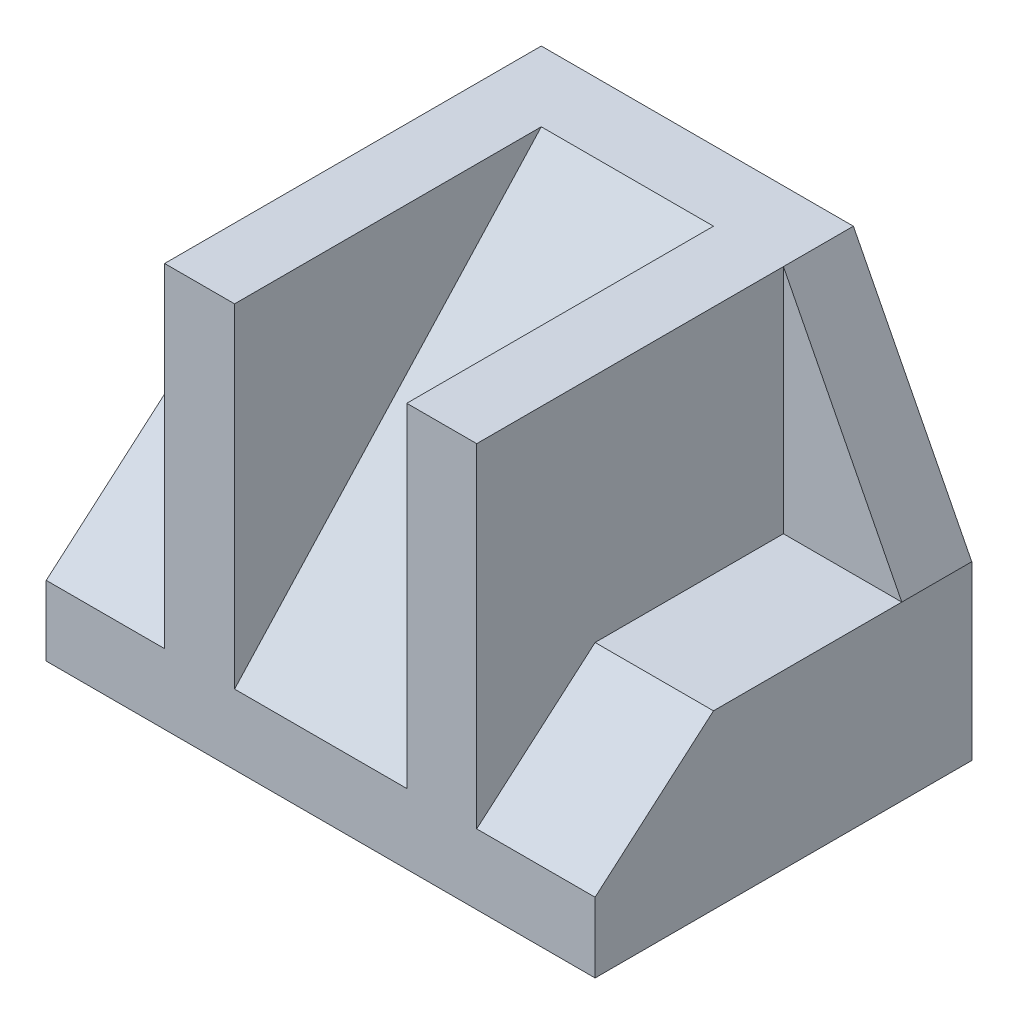
from build123d import *

# Parameters (mm, degrees)
BOSS_EXTRUDE1_DEPTH      = 51
BOSS_EXTRUDE2_START      = 16
BOSS_EXTRUDE2_DEPTH      = 13
CUT_EXTRUDE1_REACH       = 109.121
BOSS_EXTRUDE3_DEPTH      = 16
BOSS_EXTRUDE3_DEPTH_BACK = 16


with BuildPart() as part:
    # Sketch1 → Boss-Extrude1 (new, symmetric)
    with BuildSketch(Plane(origin=(0, 0, 0), x_dir=(0, 0, -1), z_dir=(1, 0, 0))):
        Polygon((70, 75), (57, 75), (57, 32), (22, 32), (0, 13), (0, 0), (70, 0), align=None)
    extrude(amount=BOSS_EXTRUDE1_DEPTH, both=True)

    # Sketch1<3> → Boss-Extrude2 (add)
    with BuildSketch(Plane(origin=(0, 0, 0), x_dir=(0, 0, -1), z_dir=(1, 0, 0)).offset(BOSS_EXTRUDE2_START)):
        Polygon((0, 13), (57, 75), (57, 32), (22, 32), align=None)
        Polygon((0, 13), (57, 75), (0, 75), align=None)
    boss_extrude2 = extrude(amount=BOSS_EXTRUDE2_DEPTH)

    # Sketch2 → Cut-Extrude1 (cut, up to next)
    with BuildSketch(Plane.XY.offset(-57), mode=Mode.PRIVATE) as cut_extrude1_sk1:
        Polygon((29, 75), (51, 32), (51, 75), align=None)
    cut_extrude1_tool1 = extrude(cut_extrude1_sk1.sketch, amount=-CUT_EXTRUDE1_REACH, mode=Mode.PRIVATE) & part.part
    cut_extrude1 = cut_extrude1_tool1.solids().sort_by_distance((43.666667, 60.666667, -57))[0]
    add(cut_extrude1, mode=Mode.SUBTRACT)

    # Mirror1: Boss-Extrude2, Cut-Extrude1 across plane
    add(boss_extrude2.mirror(Plane(origin=(0, 0, 0), x_dir=(0, 0, 1), z_dir=(1, 0, 0))))
    add(cut_extrude1.mirror(Plane(origin=(0, 0, 0), x_dir=(0, 0, 1), z_dir=(1, 0, 0))), mode=Mode.SUBTRACT)

    # Sketch1<4> → Boss-Extrude3 (add, two sides: drawn at the far end of the back side and taken through both)
    with BuildSketch(Plane(origin=(0, 0, 0), x_dir=(0, 0, -1), z_dir=(1, 0, 0)).offset(-BOSS_EXTRUDE3_DEPTH_BACK)):
        Polygon((0, 13), (57, 75), (57, 32), (22, 32), align=None)
    extrude(amount=BOSS_EXTRUDE3_DEPTH + BOSS_EXTRUDE3_DEPTH_BACK)


solid = part.part
